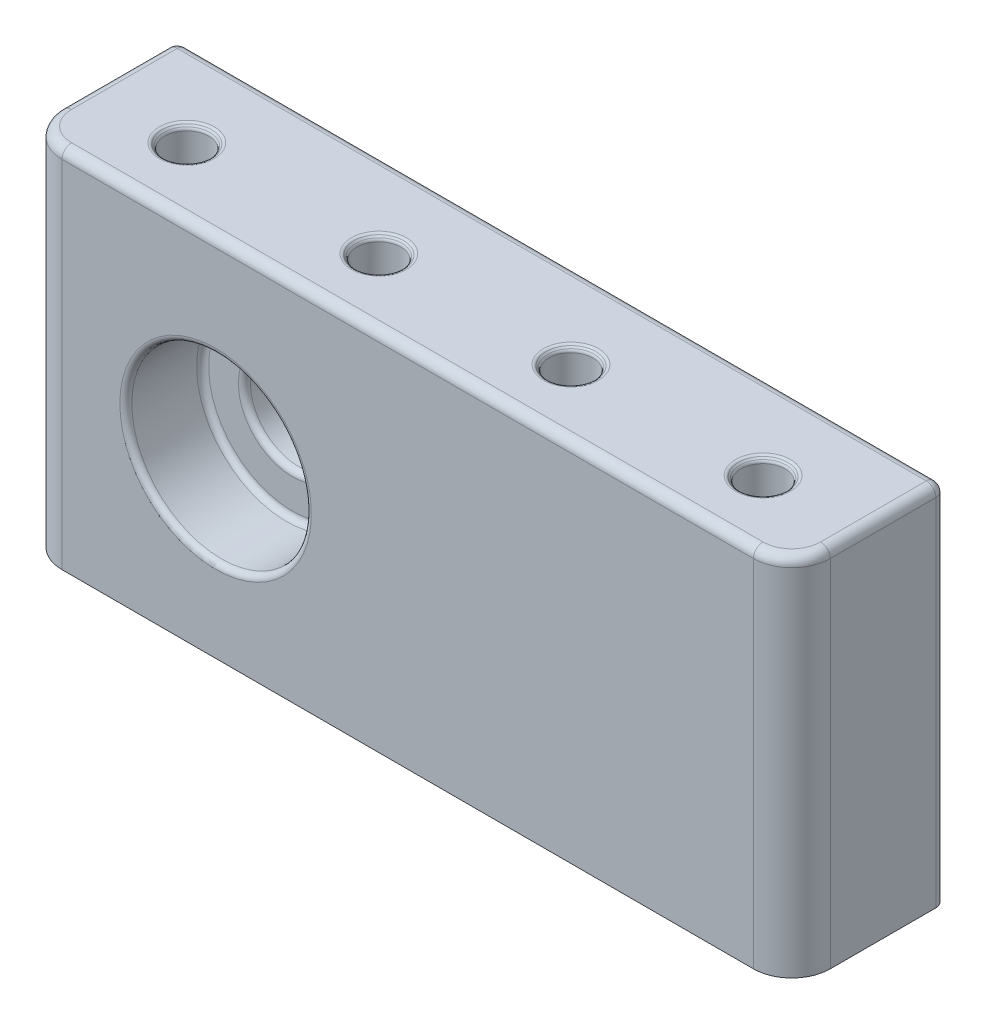
from build123d import *

# Parameters (mm, degrees)
SKETCH2_W           = 40
SKETCH2_H           = 19
BOSS_EXTRUDE1_DEPTH = 8
FILLET1_R           = 2
SKETCH5_R           = 1.15
CUT_EXTRUDE3_DEPTH  = 7
CHAMFER1_SIZE       = 0.2
FILLET3_R           = 0.2
FILLET2_R           = 0.5
SKETCH3_R           = 4.675
CUT_EXTRUDE1_DEPTH  = 4
SKETCH4_R           = 2.5
CUT_EXTRUDE2_DEPTH  = 4
CHAMFER2_SIZE       = 1.5
FILLET4_R           = 0.3125


with BuildPart() as part:
    # Sketch2 → Boss-Extrude1 (new body)
    with BuildSketch(Plane.XY):
        Rectangle(SKETCH2_W, SKETCH2_H)
    extrude(amount=BOSS_EXTRUDE1_DEPTH)

    # Fillet1
    fillet1_edges = [part.edges().sort_by_distance(p)[0] for p in [
        (-20, 0, 8),
        (20, 0, 8),
    ]]
    fillet(fillet1_edges, radius=FILLET1_R)

    # Sketch5 → Cut-Extrude3 (cut)
    with BuildSketch(Plane(origin=(0, 9.5, 0), x_dir=(1, 0, 0), z_dir=(0, 1, 0))):
        with Locations(Location((-15, -4.5, 0), (0, 0, 270))):
            Circle(SKETCH5_R)
        with Locations(Location((-5, -4.5, 0), (0, 0, 270))):
            Circle(SKETCH5_R)
        with Locations(Location((5, -4.5, 0), (0, 0, 270))):
            Circle(SKETCH5_R)
        with Locations(Location((15, -4.5, 0), (0, 0, 270))):
            Circle(SKETCH5_R)
    extrude(amount=-CUT_EXTRUDE3_DEPTH, mode=Mode.SUBTRACT)

    # Chamfer1
    chamfer1_edges = [part.edges().sort_by_distance(p)[0] for p in [
        (-15, 2.5, 3.35),
        (-15, 9.5, 3.35),
        (-5, 2.5, 3.35),
        (-5, 9.5, 3.35),
        (5, 2.5, 3.35),
        (5, 9.5, 3.35),
        (15, 2.5, 3.35),
        (15, 9.5, 3.35),
    ]]
    chamfer(chamfer1_edges, length=CHAMFER1_SIZE)

    # Fillet3
    fillet3_edges = [part.edges().sort_by_distance(p)[0] for p in [
        (15, 9.3, 3.35),
        (-15, 9.5, 3.15),
        (-5, 9.5, 3.15),
        (5, 9.5, 3.15),
        (15, 9.5, 3.15),
        (5, 9.3, 3.35),
        (-5, 9.3, 3.35),
        (-15, 9.3, 3.35),
    ]]
    fillet(fillet3_edges, radius=FILLET3_R)

    # Fillet2
    fillet2_edges = [part.edges().sort_by_distance(p)[0] for p in [
        (0, 9.5, 8),
        (-20, 9.5, 3),
        (20, 9.5, 3),
        (-19.414213562, 9.5, 7.414213562),
        (19.414213562, 9.5, 7.414213562),
        (-20, 0, 0),
        (0, 9.5, 0),
        (20, 0, 0),
    ]]
    fillet(fillet2_edges, radius=FILLET2_R)

    # Sketch3 → Cut-Extrude1 (cut)
    with BuildSketch(Plane.XY.offset(8)):
        with Locations((-10, -0.5)):
            Circle(SKETCH3_R)
    extrude(amount=-CUT_EXTRUDE1_DEPTH, mode=Mode.SUBTRACT)

    # Sketch4 → Cut-Extrude2 (cut)
    with BuildSketch(Plane.XY.offset(4)):
        with Locations((-10, -0.5)):
            Circle(SKETCH4_R)
    extrude(amount=-CUT_EXTRUDE2_DEPTH, mode=Mode.SUBTRACT)

    # Chamfer2
    chamfer2_edges = [part.edges().sort_by_distance(p)[0] for p in [
        (-12.5, -0.5, 0),
    ]]
    chamfer(chamfer2_edges, length=CHAMFER2_SIZE)

    # Fillet4
    fillet4_edges = [part.edges().sort_by_distance(p)[0] for p in [
        (-14.675, -0.5, 4),
        (-14.675, -0.5, 8),
        (-12.5, -0.5, 4),
        (-14, -0.5, 0),
        (-12.5, -0.5, 1.5),
    ]]
    fillet(fillet4_edges, radius=FILLET4_R)


solid = part.part
